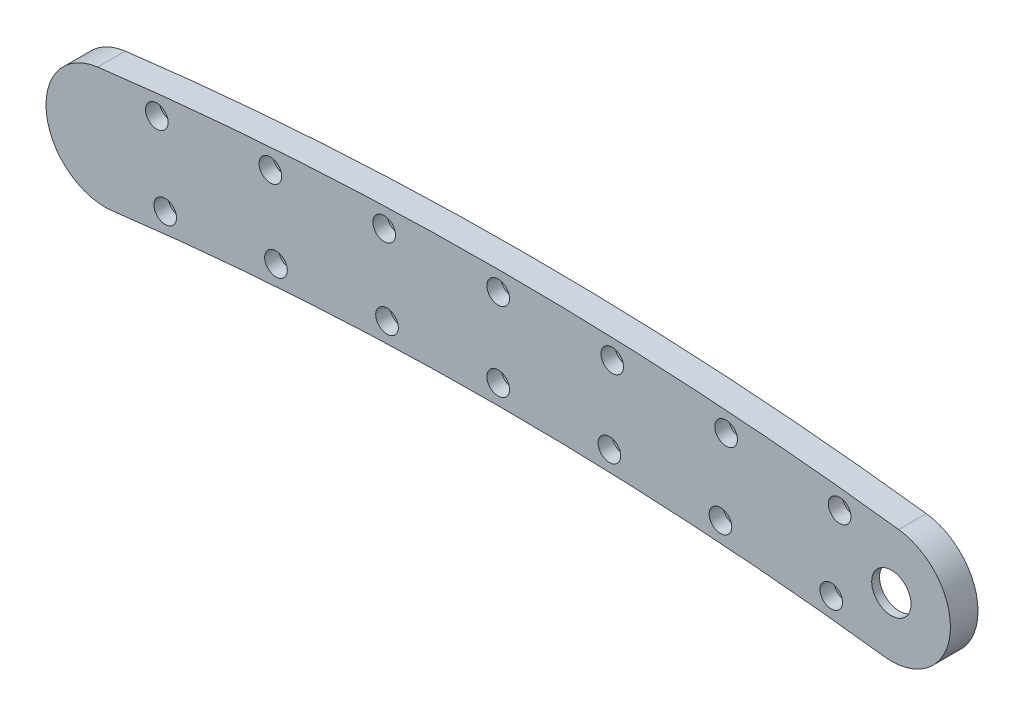
from build123d import *

# Parameters (mm, degrees)
SKETCH1_R           = 13.3
BOSS_EXTRUDE1_DEPTH = 5
BOSS_EXTRUDE2_DEPTH = 2
CUT_EXTRUDE1_DEPTH  = 5
SKETCH4_R           = 5
CUT_EXTRUDE2_DEPTH  = 5
SKETCH5_R           = 1.775
CUT_EXTRUDE3_DEPTH  = 7
SKETCH6_R           = 2.875
CUT_EXTRUDE4_DEPTH  = 3.6


with BuildPart() as part:
    # Sketch1 → Boss-Extrude1 (new body)
    with BuildSketch(Plane.XY):
        with BuildLine():
            ThreePointArc((-97.97591629, 3.871645852), (-3.59e-07, 10), (97.975915577, 3.871645942))
            ThreePointArc((97.975915577, 3.871645942), (114.728175723, 16.885553085), (101.714268612, 33.637813256))
            ThreePointArc((101.714268612, 33.637813256), (2.3e-07, 40), (-101.714268155, 33.637813313))
            ThreePointArc((-101.714268155, 33.637813313), (-114.728175796, 16.88555367), (-97.97591629, 3.871645852))
        make_face()
        with Locations((-71.408926643, 21.811606454)):
            Circle(SKETCH1_R, mode=Mode.SUBTRACT)
        with BuildLine():
            ThreePointArc((84.645708431, 20.516381409), (70.223605302, 8.564530802), (58.152469631, 22.886942442))
            ThreePointArc((58.152469631, 22.886942442), (72.594247984, 35.058682105), (84.645708431, 20.516381409))
        make_face(mode=Mode.SUBTRACT)
        with Locations((99.845092065, 18.754729603)):
            Circle(SKETCH1_R, mode=Mode.SUBTRACT)
        with Locations((-42.881780686, 23.851690653)):
            Circle(SKETCH1_R, mode=Mode.SUBTRACT)
        with Locations((-14.3, 24.872382973)):
            Circle(SKETCH1_R, mode=Mode.SUBTRACT)
        with BuildLine():
            ThreePointArc((1.000606293, 24.999375218), (14.537366615, 38.17026465), (27.595453643, 24.524658339))
            ThreePointArc((27.595453643, 24.524658339), (14.062633385, 11.574501296), (1.000606293, 24.999375218))
        make_face(mode=Mode.SUBTRACT)
        with BuildLine():
            ThreePointArc((29.595391379, 24.453237978), (43.593578107, 37.132629792), (56.156354822, 23.029692169))
            ThreePointArc((56.156354822, 23.029692169), (42.169983266, 10.570751513), (29.595391379, 24.453237978))
        make_face(mode=Mode.SUBTRACT)
        with Locations((-99.845092065, 18.754729603)):
            Circle(SKETCH1_R, mode=Mode.SUBTRACT)
    extrude(amount=BOSS_EXTRUDE1_DEPTH)

    # Sketch2 → Boss-Extrude2 (add)
    with BuildSketch(Plane.XY.offset(5)):
        with BuildLine():
            ThreePointArc((101.714266956, 33.637813464), (0, 40), (-101.714266956, 33.637813464))
            ThreePointArc((-101.714266956, 33.637813464), (-114.728175927, 16.885554712), (-97.975917175, 3.871645741))
            ThreePointArc((-97.975917175, 3.871645741), (0, 10), (97.975917175, 3.871645741))
            ThreePointArc((97.975917175, 3.871645741), (114.728175927, 16.885554712), (101.714266956, 33.637813464))
        make_face()
    extrude(amount=BOSS_EXTRUDE2_DEPTH)

    # Sketch3 → Cut-Extrude1 (cut)
    with BuildSketch(Plane(origin=(0, 0, 0), x_dir=(-1, 0, 0), z_dir=(0, 0, -1))):
        with BuildLine():
            ThreePointArc((-87.020494046, 15.230572166), (-85.106230518, 15.438696412), (-83.191469288, 15.642190855))
            ThreePointArc((-83.191469288, 15.642190855), (-84.646494513, 20.524440227), (-84.159292066, 25.595543767))
            ThreePointArc((-84.159292066, 25.595543767), (-86.175068578, 25.381411595), (-88.190300336, 25.162211928))
            ThreePointArc((-88.190300336, 25.162211928), (-86.962958508, 22.062392675), (-86.545092065, 18.754729603))
            ThreePointArc((-86.545092065, 18.754729603), (-86.664478391, 16.976690466), (-87.020494046, 15.230572166))
        make_face()
        with BuildLine():
            ThreePointArc((-58.718270435, 17.832002829), (-56.797798717, 17.971677217), (-54.876994844, 18.106706988))
            ThreePointArc((-54.876994844, 18.106706988), (-56.156852796, 23.037773907), (-55.488980421, 28.088259411))
            ThreePointArc((-55.488980421, 28.088259411), (-57.51111487, 27.946203775), (-59.532885764, 27.799064431))
            ThreePointArc((-59.532885764, 27.799064431), (-58.469812615, 24.888833802), (-58.108926643, 21.811606454))
            ThreePointArc((-58.108926643, 21.811606454), (-58.262145144, 19.798614597), (-58.718270435, 17.832002829))
        make_face()
        with BuildLine():
            ThreePointArc((-30.341235174, 19.421711165), (-28.417002095, 19.492757738), (-26.492602834, 19.559150799))
            ThreePointArc((-26.492602834, 19.559150799), (-27.595662875, 24.532752701), (-26.747971493, 29.556185457))
            ThreePointArc((-26.747971493, 29.556185457), (-28.773887522, 29.486387348), (-30.799621658, 29.411495794))
            ThreePointArc((-30.799621658, 29.411495794), (-29.889807874, 26.697502042), (-29.581780686, 23.851690653))
            ThreePointArc((-29.581780686, 23.851690653), (-29.773019202, 21.604387303), (-30.341235174, 19.421711165))
        make_face()
        with BuildLine():
            ThreePointArc((-1.925542816, 19.997671761), (0, 20), (1.925542816, 19.997671761))
            ThreePointArc((1.925542816, 19.997671761), (1.000686071, 25.00747189), (2.027116435, 29.997451654))
            ThreePointArc((2.027116435, 29.997451654), (0, 30), (-2.027116435, 29.997451654))
            ThreePointArc((-2.027116435, 29.997451654), (-1.259306931, 27.485871884), (-1, 24.872382973))
            ThreePointArc((-1, 24.872382973), (-1.233434259, 22.391483998), (-1.925542816, 19.997671761))
        make_face()
        with BuildLine():
            ThreePointArc((26.492602834, 19.559150799), (28.417002095, 19.492757738), (30.341235174, 19.421711165))
            ThreePointArc((30.341235174, 19.421711165), (29.595760065, 24.461326646), (30.799621658, 29.411495794))
            ThreePointArc((30.799621658, 29.411495794), (28.773887522, 29.486387348), (26.747971493, 29.556185457))
            ThreePointArc((26.747971493, 29.556185457), (27.38525928, 27.252716893), (27.6, 24.872382973))
            ThreePointArc((27.6, 24.872382973), (27.320207711, 22.158678649), (26.492602834, 19.559150799))
        make_face()
        with BuildLine():
            ThreePointArc((54.876994844, 18.106706988), (56.797798717, 17.971677217), (58.718270435, 17.832002829))
            ThreePointArc((58.718270435, 17.832002829), (58.153126754, 22.895012799), (59.532885764, 27.799064431))
            ThreePointArc((59.532885764, 27.799064431), (57.51111487, 27.946203775), (55.488980421, 28.088259411))
            ThreePointArc((55.488980421, 28.088259411), (56.007437936, 25.998111339), (56.181780686, 23.851690653))
            ThreePointArc((56.181780686, 23.851690653), (55.851482847, 20.906045418), (54.876994844, 18.106706988))
        make_face()
        with BuildLine():
            ThreePointArc((83.191469288, 15.642190855), (85.106230518, 15.438696412), (87.020494046, 15.230572166))
            ThreePointArc((87.020494046, 15.230572166), (86.636401831, 20.310525956), (88.190300336, 25.162211928))
            ThreePointArc((88.190300336, 25.162211928), (86.175068578, 25.381411595), (84.159292066, 25.595543767))
            ThreePointArc((84.159292066, 25.595543767), (84.570800752, 23.723430175), (84.708926643, 21.811606454))
            ThreePointArc((84.708926643, 21.811606454), (84.323991823, 18.634958627), (83.191469288, 15.642190855))
        make_face()
    extrude(amount=-CUT_EXTRUDE1_DEPTH, mode=Mode.SUBTRACT)

    # Sketch4 → Cut-Extrude2 (cut)
    with BuildSketch(Plane(origin=(0, 0, 5), x_dir=(-1, 0, 0), z_dir=(0, 0, -1))):
        with Locations((-99.845092065, 18.754729603)):
            Circle(SKETCH4_R)
    extrude(amount=-CUT_EXTRUDE2_DEPTH, mode=Mode.SUBTRACT)

    # Sketch5 → Cut-Extrude3 (cut)
    with BuildSketch(Plane(origin=(0, 0, 0), x_dir=(-1, 0, 0), z_dir=(0, 0, -1))):
        with BuildLine():
            ThreePointArc((86.346811488, 10.467338821), (84.665812962, 12.239847981), (82.806767857, 10.655077946))
            ThreePointArc((82.806767857, 10.655077946), (84.571811488, 10.467338821), (86.336429526, 10.275640673))
            ThreePointArc((86.336429526, 10.275640673), (86.344214097, 10.371349284), (86.346811488, 10.467338821))
        make_face()
        with BuildLine():
            ThreePointArc((86.336429526, 10.275640673), (84.571811488, 10.467338821), (82.806767857, 10.655077946))
            ThreePointArc((82.806767857, 10.655077946), (84.382092732, 8.702506876), (86.336429526, 10.275640673))
        make_face()
        with Locations(Location((86.709487608, 30.352769186, 0), (0, 0, 180))):
            Circle(SKETCH5_R)
        with Locations(Location((57.867772947, 32.933467054, 0), (0, 0, 180))):
            Circle(SKETCH5_R)
        with Locations(Location((56.44114064, 12.984413937, 0), (0, 0, 180))):
            Circle(SKETCH5_R)
        with Locations(Location((28.238559382, 14.495942932, 0), (0, 0, 180))):
            Circle(SKETCH5_R)
        with Locations(Location((28.952330235, 34.483202153, 0), (0, 0, 180))):
            Circle(SKETCH5_R)
        with Locations((0, 35)):
            Circle(SKETCH5_R)
        with Locations((0, 15)):
            Circle(SKETCH5_R)
        with Locations((-28.238559382, 14.495942932)):
            Circle(SKETCH5_R)
        with Locations((-28.952330235, 34.483202153)):
            Circle(SKETCH5_R)
        with Locations((-56.44114064, 12.984413937)):
            Circle(SKETCH5_R)
        with Locations((-57.867772947, 32.933467054)):
            Circle(SKETCH5_R)
        with Locations((-86.709487608, 30.352769186)):
            Circle(SKETCH5_R)
        with Locations((-84.571811488, 10.467338821)):
            Circle(SKETCH5_R)
    extrude(amount=-CUT_EXTRUDE3_DEPTH, mode=Mode.SUBTRACT)

    # Sketch6 → Cut-Extrude4 (cut)
    with BuildSketch(Plane.XY.offset(7)):
        with Locations((-86.709487608, 30.352769186)):
            Circle(SKETCH6_R)
        with Locations((-84.571811488, 10.467338821)):
            Circle(SKETCH6_R)
        with Locations((-57.867772947, 32.933467054)):
            Circle(SKETCH6_R)
        with Locations((-56.44114064, 12.984413937)):
            Circle(SKETCH6_R)
        with Locations((-28.952330235, 34.483202153)):
            Circle(SKETCH6_R)
        with Locations((-28.238559382, 14.495942932)):
            Circle(SKETCH6_R)
        with Locations((0, 35)):
            Circle(SKETCH6_R)
        with Locations((0, 15)):
            Circle(SKETCH6_R)
        with Locations((28.952330235, 34.483202153)):
            Circle(SKETCH6_R)
        with Locations((28.238559382, 14.495942932)):
            Circle(SKETCH6_R)
        with Locations((57.867772947, 32.933467054)):
            Circle(SKETCH6_R)
        with Locations((56.44114064, 12.984413937)):
            Circle(SKETCH6_R)
        with Locations((86.709487608, 30.352769186)):
            Circle(SKETCH6_R)
        with Locations((84.571811488, 10.467338821)):
            Circle(SKETCH6_R)
    extrude(amount=-CUT_EXTRUDE4_DEPTH, mode=Mode.SUBTRACT)


solid = part.part
